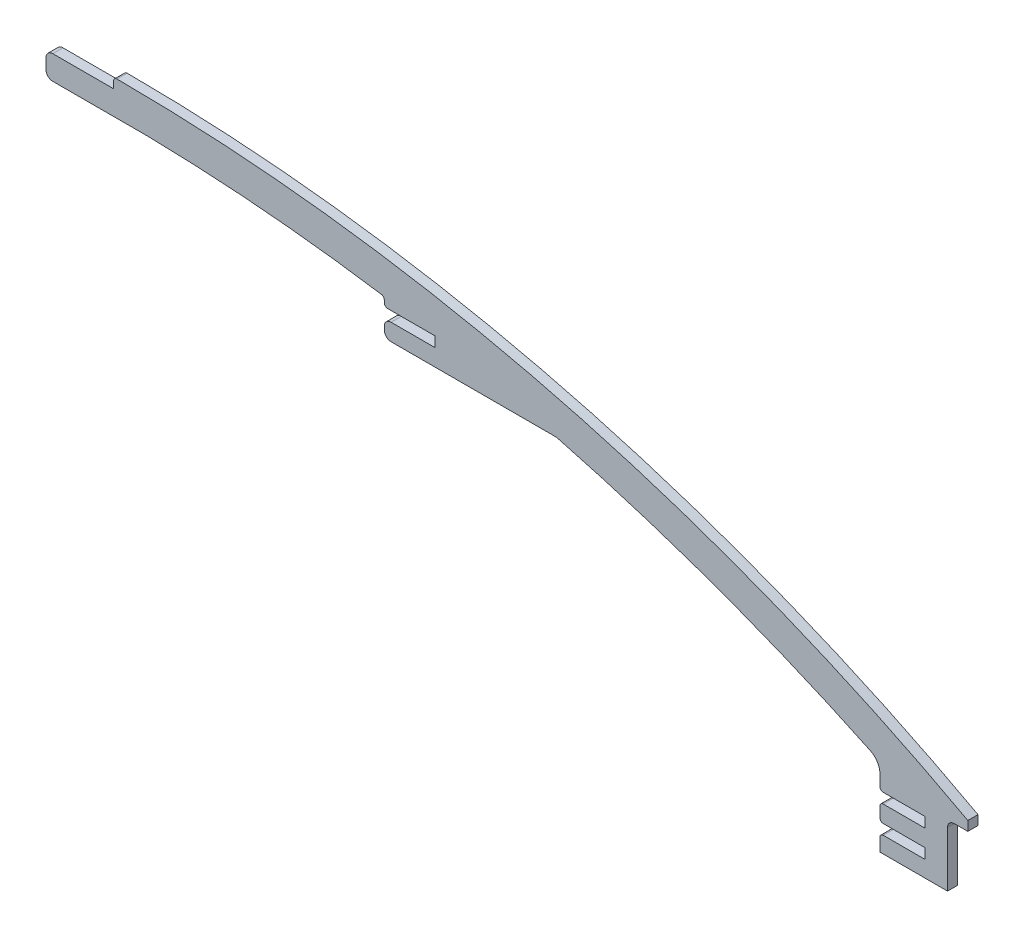
from build123d import *

# Parameters (mm, degrees)
BOSS_EXTRUDE1_DEPTH = 1.5
SKETCH3_W           = 13.3
SKETCH3_H           = 3
CUT_EXTRUDE1_DEPTH  = 10
FILLET1_R           = 1
SKETCH4_W           = 2
SKETCH4_H           = 7.019019915
CUT_EXTRUDE2_DEPTH  = 10
BOSS_EXTRUDE2_DEPTH = 3


with BuildPart() as part:
    # Sketch2 → Boss-Extrude1 (new, symmetric)
    with BuildSketch(Plane.XY):
        with BuildLine():
            Line((299.5, -67.353443934), (293.5, -67.353443934))
            ThreePointArc((293.5, -67.353443934), (292.085786438, -67.939230372), (291.5, -69.353443934))
            Line((291.5, -69.353443934), (291.5, -85.649534053))
            Line((291.5, -85.649534053), (271.5, -85.649534053))
            Line((271.5, -85.649534053), (271.5, -65.603161932))
            ThreePointArc((271.5, -65.603161932), (270.728442335, -62.934777511), (268.651889832, -61.089918071))
            ThreePointArc((268.651889832, -61.089918071), (217.204334173, -39.861711653), (163.781589842, -24.257285386))
            Line((163.781589842, -24.257285386), (141, -24.257285386))
            ThreePointArc((141, -24.257285386), (140.292893219, -23.964392167), (140, -23.257285386))
            Line((140, -23.257285386), (140, -19.257285386))
            Line((140, -19.257285386), (126, -19.257285386))
            ThreePointArc((126, -19.257285386), (125.292893219, -18.964392167), (125, -18.257285386))
            Line((125, -18.257285386), (125, -17.551725847))
            ThreePointArc((125, -17.551725847), (124.759050209, -16.900693759), (124.152314439, -16.563393762))
            ThreePointArc((124.152314439, -16.563393762), (89.724531973, -12.428170907), (55.097618142, -10.598112953))
            ThreePointArc((55.097618142, -10.598112953), (55.000467449, -10.596696958), (54.903307584, -10.596224945))
            Line((54.903307584, -10.596224945), (27, -10.596224945))
            ThreePointArc((27, -10.596224945), (25.585786438, -10.010438507), (25, -8.596224945))
            Line((25, -8.596224945), (25, -5.5))
            ThreePointArc((25, -5.5), (25.585786438, -4.085786438), (27, -3.5))
            Line((27, -3.5), (45, -3.5))
            Line((45, -3.5), (45, -1.500945781))
            ThreePointArc((45, -1.500945781), (45.293562303, -0.793170548), (46.001891561, -0.50094757))
            ThreePointArc((46.001891561, -0.50094757), (176.838494864, -17.170276226), (299.5, -65.649534053))
            Line((299.5, -65.649534053), (299.5, -67.353443934))
        make_face()
    extrude(amount=BOSS_EXTRUDE1_DEPTH, both=True)

    # Sketch3 → Cut-Extrude1 (cut)
    with BuildSketch(Plane.XY.offset(1.5)):
        with Locations((278.15, -71.353443934)):
            Rectangle(SKETCH3_W, SKETCH3_H)
        with Locations((278.15, -79.353443934)):
            Rectangle(SKETCH3_W, SKETCH3_H)
    extrude(amount=-CUT_EXTRUDE1_DEPTH, mode=Mode.SUBTRACT)

    # Fillet1
    fillet1_edges = [part.edges().sort_by_distance(p)[0] for p in [
        (271.5, -72.853443934, 0),
        (271.5, -69.853443934, 0),
        (271.5, -80.853443934, 0),
        (271.5, -77.853443934, 0),
    ]]
    fillet(fillet1_edges, radius=FILLET1_R)

    # Sketch4 → Cut-Extrude2 (cut)
    with BuildSketch(Plane.XY.offset(1.5)):
        with Locations((298.5, -66.105228371)):
            Rectangle(SKETCH4_W, SKETCH4_H)
    extrude(amount=-CUT_EXTRUDE2_DEPTH, mode=Mode.SUBTRACT)

    # Sketch5 → Boss-Extrude2 (add)
    with BuildSketch(Plane.XY.offset(1.5)):
        with BuildLine():
            Line((140, -19.257285386), (140, -22.257285386))
            Line((140, -22.257285386), (127, -22.257285386))
            ThreePointArc((127, -22.257285386), (125.585786438, -22.843071823), (125, -24.257285386))
            Line((125, -24.257285386), (125, -25.257285386))
            ThreePointArc((125, -25.257285386), (125.585786438, -26.671498948), (127, -27.257285386))
            Line((127, -27.257285386), (175.902657485, -27.257285386))
            Line((175.902657485, -27.257285386), (184.756236065, -23.311413726))
            Line((184.756236065, -23.311413726), (140, -19.257285386))
        make_face()
    extrude(amount=-BOSS_EXTRUDE2_DEPTH)


solid = part.part
